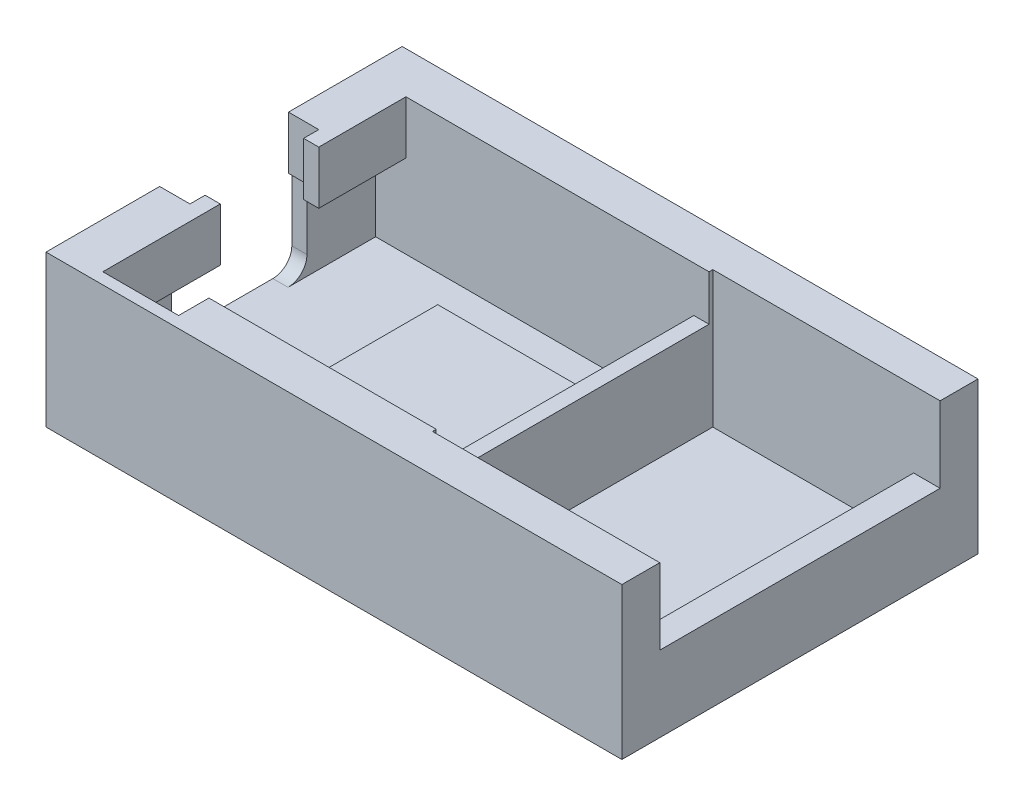
from build123d import *

# Parameters (mm, degrees)
SKETCH1_W           = 40
SKETCH1_H           = 24
BOSS_EXTRUDE1_DEPTH = 1
SKETCH2_W           = 40
SKETCH2_H           = 24
SKETCH2_W_2         = 21
SKETCH2_H_2         = 17.5
SKETCH2_W_3         = 13
SKETCH2_H_3         = 18.5
BOSS_EXTRUDE3_DEPTH = 9
SKETCH3_W           = 1
SKETCH3_H           = 17.5
CUT_EXTRUDE2_DEPTH  = 3
SKETCH4_W           = 10.24
SKETCH4_H           = 11.92
BOSS_EXTRUDE4_DEPTH = 1.21
CUT_EXTRUDE3_DEPTH  = 2
SKETCH8_W           = 4
SKETCH8_H           = 18.5
CUT_EXTRUDE4_DEPTH  = 5
SKETCH11_W          = 24
SKETCH11_H          = 10
CUT_EXTRUDE5_DEPTH  = 2
SKETCH12_W          = 4
SKETCH12_H          = 3
CUT_EXTRUDE6_DEPTH  = 3
BOSS_EXTRUDE5_DEPTH = 3.5
SKETCH14_W          = 1
SKETCH14_H          = 2.25
CUT_EXTRUDE7_DEPTH  = 3
SKETCH15_W          = 38
SKETCH15_H          = 10
CUT_EXTRUDE8_DEPTH  = 0.25
SKETCH16_W          = 38
SKETCH16_H          = 10
CUT_EXTRUDE9_DEPTH  = 0.25
SKETCH17_W          = 18.5
SKETCH17_H          = 4
CUT_EXTRUDE10_DEPTH = 0.25
CUT_EXTRUDE11_DEPTH = 0.25
CUT_EXTRUDE12_DEPTH = 0.25


with BuildPart() as part:
    # Sketch1 → Boss-Extrude1 (new body)
    with BuildSketch(Plane(origin=(0, 0, 0), x_dir=(1, 0, 0), z_dir=(0, 1, 0))):
        with Locations((20, 12)):
            Rectangle(SKETCH1_W, SKETCH1_H)
    extrude(amount=BOSS_EXTRUDE1_DEPTH)

    # Sketch2 → Boss-Extrude3 (add)
    with BuildSketch(Plane(origin=(0, 1, 0), x_dir=(1, 0, 0), z_dir=(0, 1, 0))):
        with Locations((20, 12)):
            Rectangle(SKETCH2_W, SKETCH2_H)
        with Locations((11.5, 12)):
            Rectangle(SKETCH2_W_2, SKETCH2_H_2, mode=Mode.SUBTRACT)
        with Locations((29.5, 12)):
            Rectangle(SKETCH2_W_3, SKETCH2_H_3, mode=Mode.SUBTRACT)
    extrude(amount=BOSS_EXTRUDE3_DEPTH)

    # Sketch3 → Cut-Extrude2 (cut)
    with BuildSketch(Plane(origin=(0, 10, 0), x_dir=(1, 0, 0), z_dir=(0, 1, 0))):
        with Locations((22.5, 12)):
            Rectangle(SKETCH3_W, SKETCH3_H)
    extrude(amount=-CUT_EXTRUDE2_DEPTH, mode=Mode.SUBTRACT)

    # Sketch4 → Boss-Extrude4 (add)
    with BuildSketch(Plane(origin=(0, 1, 0), x_dir=(1, 0, 0), z_dir=(0, 1, 0))):
        with Locations((13.26, 12)):
            Rectangle(SKETCH4_W, SKETCH4_H)
    extrude(amount=BOSS_EXTRUDE4_DEPTH)

    # Sketch5 → Cut-Extrude3 (cut)
    with BuildSketch(Plane(origin=(1, 0, 0), x_dir=(0, 0, -1), z_dir=(1, 0, 0))):
        with BuildLine():
            Line((7.53, 2.25), (7.53, 2.96))
            Line((7.53, 2.96), (7.53, 10))
            Line((7.53, 10), (16.47, 10))
            Line((16.47, 10), (16.47, 2.96))
            Line((16.47, 2.96), (16.47, 2.25))
            ThreePointArc((16.47, 2.25), (16.103883476, 1.366116524), (15.22, 1))
            Line((15.22, 1), (8.78, 1))
            ThreePointArc((8.78, 1), (7.896116524, 1.366116524), (7.53, 2.25))
        make_face()
    extrude(amount=-CUT_EXTRUDE3_DEPTH, mode=Mode.SUBTRACT)

    # Sketch8 → Cut-Extrude4 (cut)
    with BuildSketch(Plane(origin=(0, 10, 0), x_dir=(1, 0, 0), z_dir=(0, 1, 0))):
        with Locations((38, 12)):
            Rectangle(SKETCH8_W, SKETCH8_H)
    extrude(amount=-CUT_EXTRUDE4_DEPTH, mode=Mode.SUBTRACT)

    # Sketch11 → Cut-Extrude5 (cut)
    with BuildSketch(Plane(origin=(40, 0, 0), x_dir=(0, 0, -1), z_dir=(1, 0, 0))):
        with Locations((12, 5)):
            Rectangle(SKETCH11_W, SKETCH11_H)
    extrude(amount=-CUT_EXTRUDE5_DEPTH, mode=Mode.SUBTRACT)

    # Sketch12 → Cut-Extrude6 (cut)
    with BuildSketch(Plane(origin=(0, 10, 0), x_dir=(1, 0, 0), z_dir=(0, 1, 0))):
        with Locations((6, 2.5)):
            Rectangle(SKETCH12_W, SKETCH12_H)
    extrude(amount=-CUT_EXTRUDE6_DEPTH, mode=Mode.SUBTRACT)

    # Sketch13 → Boss-Extrude5 (add)
    with BuildSketch(Plane(origin=(0, 10, 0), x_dir=(1, 0, 0), z_dir=(0, 1, 0))):
        Polygon((1, 16.47), (1, 20.75), (3, 20.75), (3, 15.25), (2, 15.25), (2, 16.25), (0, 16.25), (0, 16.47), align=None)
        Polygon((1, 3.25), (3, 3.25), (3, 8.75), (2, 8.75), (2, 7.75), (0, 7.75), (0, 7.53), (1, 7.53), align=None)
    extrude(amount=-BOSS_EXTRUDE5_DEPTH)

    # Sketch14 → Cut-Extrude7 (cut)
    with BuildSketch(Plane(origin=(0, 10, 0), x_dir=(1, 0, 0), z_dir=(0, 1, 0))):
        with Locations((3.5, 2.125)):
            Rectangle(SKETCH14_W, SKETCH14_H)
    extrude(amount=-CUT_EXTRUDE7_DEPTH, mode=Mode.SUBTRACT)

    # Sketch15 → Cut-Extrude8 (cut)
    with BuildSketch(Plane(origin=(0, 0, -24), x_dir=(-1, 0, 0), z_dir=(0, 0, -1))):
        with Locations((-19, 5)):
            Rectangle(SKETCH15_W, SKETCH15_H)
    extrude(amount=-CUT_EXTRUDE8_DEPTH, mode=Mode.SUBTRACT)

    # Sketch16 → Cut-Extrude9 (cut)
    with BuildSketch(Plane.XY):
        with Locations((19, 5)):
            Rectangle(SKETCH16_W, SKETCH16_H)
    extrude(amount=-CUT_EXTRUDE9_DEPTH, mode=Mode.SUBTRACT)

    # Sketch17 → Cut-Extrude10 (cut)
    with BuildSketch(Plane.ZY.offset(-36)):
        with Locations((-12, 3)):
            Rectangle(SKETCH17_W, SKETCH17_H)
    extrude(amount=-CUT_EXTRUDE10_DEPTH, mode=Mode.SUBTRACT)

    # Sketch18 → Cut-Extrude11 (cut)
    with BuildSketch(Plane(origin=(0, 0, -3.25), x_dir=(-1, 0, 0), z_dir=(0, 0, -1))):
        Polygon((-1, 1), (-1, 6.483981395), (-3, 6.5), (-3, 7), (-8, 7), (-8, 10), (-23, 10), (-23, 7), (-22, 7), (-22, 1), align=None)
    extrude(amount=-CUT_EXTRUDE11_DEPTH, mode=Mode.SUBTRACT)

    # Sketch19 → Cut-Extrude12 (cut)
    with BuildSketch(Plane.XY.offset(-20.75)):
        Polygon((1, 1), (1, 6.5), (3, 6.5), (3, 10), (23, 10), (23, 7), (22, 7), (22, 1), align=None)
    extrude(amount=-CUT_EXTRUDE12_DEPTH, mode=Mode.SUBTRACT)


solid = part.part
